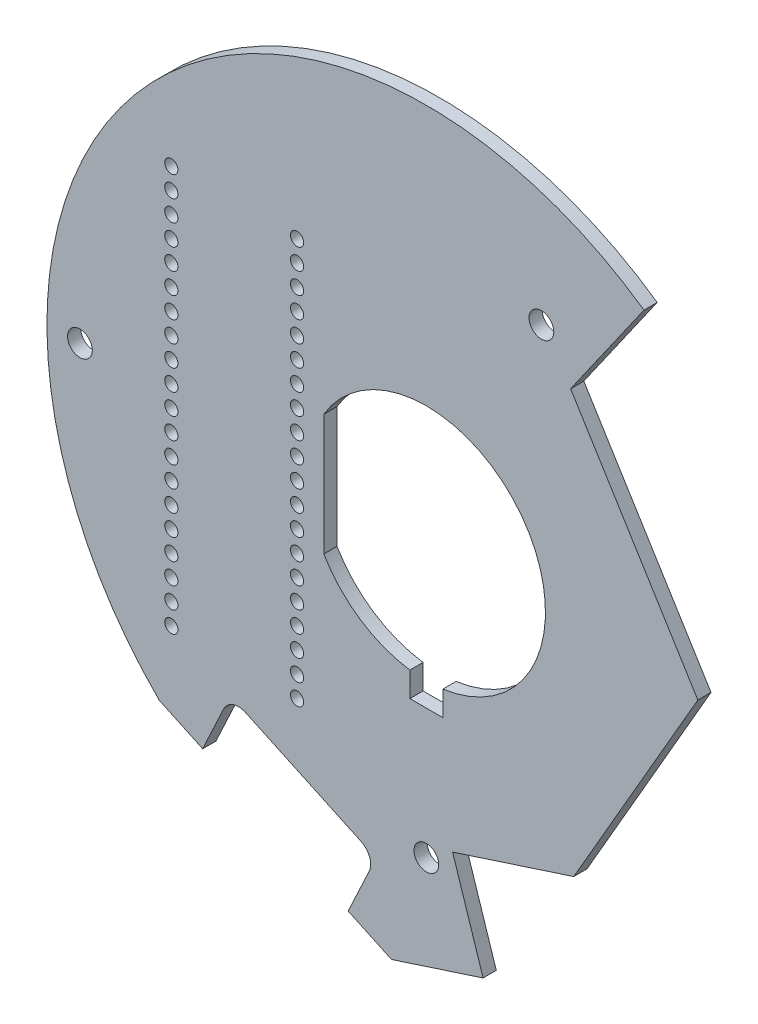
from build123d import *

# Parameters (mm, degrees)
BOSS_EXTRUDE1_DEPTH = 1.6
CUT_EXTRUDE1_DEPTH  = 1.6
SKETCH3_W           = 4
SKETCH3_H           = 3
CUT_EXTRUDE2_DEPTH  = 1.6
SKETCH4_R           = 1.5
CUT_EXTRUDE3_DEPTH  = 5
SKETCH5_R           = 0.8
CUT_EXTRUDE4_DEPTH  = 10
CUT_EXTRUDE5_DEPTH  = 10
CUT_EXTRUDE6_DEPTH  = 5
FILLET1_R           = 2


with BuildPart() as part:
    # Sketch1 → Boss-Extrude1 (new body)
    with BuildSketch(Plane.XY):
        with BuildLine():
            Line((17.486502451, 24.97331362), (26.384516072, 37.680994037))
            ThreePointArc((26.384516072, 37.680994037), (-35.308070708, 29.48457466), (-32.372261705, -32.680830346))
            Line((-32.372261705, -32.680830346), (-4.226479762, -45.805424011))
            ThreePointArc((-4.226479762, -45.805424011), (1.848027324, -45.962863216), (7.890286138, -45.318245604))
            Line((7.890286138, -45.318245604), (3.181347574, -30.825622907))
            Line((3.181347574, -30.825622907), (17.866632614, -26.054084553))
            Line((17.866632614, -26.054084553), (32.908965344, 0))
            Line((32.908965344, 0), (17.486502451, 24.97331362))
        make_face()
    extrude(amount=BOSS_EXTRUDE1_DEPTH)

    # Sketch2 → Cut-Extrude1 (cut)
    with BuildSketch(Plane.XY.offset(1.6)):
        with BuildLine():
            Line((-12.439410298, 7.331960256), (-12.439410298, -7.331960256))
            ThreePointArc((-12.439410298, -7.331960256), (14.439410298, 0), (-12.439410298, 7.331960256))
        make_face()
    extrude(amount=-CUT_EXTRUDE1_DEPTH, mode=Mode.SUBTRACT)

    # Sketch3 → Cut-Extrude2 (cut)
    with BuildSketch(Plane.XY.offset(1.6)):
        with Locations((0, -15.80022971)):
            Rectangle(SKETCH3_W, SKETCH3_H)
    extrude(amount=-CUT_EXTRUDE2_DEPTH, mode=Mode.SUBTRACT)

    # Sketch4 → Cut-Extrude3 (cut)
    with BuildSketch(Plane.XY.offset(1.6)):
        with Locations((-42, 0)):
            Circle(SKETCH4_R)
        with Locations((13.946402637, 29.908156972)):
            Circle(SKETCH4_R)
        with Locations((0, -33)):
            Circle(SKETCH4_R)
    extrude(amount=-CUT_EXTRUDE3_DEPTH, mode=Mode.SUBTRACT)

    # Sketch5 → Cut-Extrude4 (cut)
    with BuildSketch(Plane.XY.offset(1.6)):
        with Locations((-30.919410298, -24.13)):
            Circle(SKETCH5_R)
        with Locations((-15.679410309, -24.13)):
            Circle(SKETCH5_R)
        with Locations((-30.919410298, -21.59)):
            Circle(SKETCH5_R)
        with Locations((-15.679410309, -21.59)):
            Circle(SKETCH5_R)
        with Locations((-30.919410298, -19.05)):
            Circle(SKETCH5_R)
        with Locations((-15.679410309, -19.05)):
            Circle(SKETCH5_R)
        with Locations((-30.919410298, -16.51)):
            Circle(SKETCH5_R)
        with Locations((-15.679410309, -16.51)):
            Circle(SKETCH5_R)
        with Locations((-30.919410298, -13.97)):
            Circle(SKETCH5_R)
        with Locations((-15.679410309, -13.97)):
            Circle(SKETCH5_R)
        with Locations((-30.919410298, -11.43)):
            Circle(SKETCH5_R)
        with Locations((-15.679410309, -11.43)):
            Circle(SKETCH5_R)
        with Locations((-30.919410298, -8.89)):
            Circle(SKETCH5_R)
        with Locations((-15.679410309, -8.89)):
            Circle(SKETCH5_R)
        with Locations((-30.919410298, -6.35)):
            Circle(SKETCH5_R)
        with Locations((-15.679410309, -6.35)):
            Circle(SKETCH5_R)
        with Locations((-30.919410298, -3.81)):
            Circle(SKETCH5_R)
        with Locations((-15.679410309, -3.81)):
            Circle(SKETCH5_R)
        with Locations((-30.919410298, -1.27)):
            Circle(SKETCH5_R)
        with Locations((-15.679410309, -1.27)):
            Circle(SKETCH5_R)
        with Locations((-30.919410298, 1.27)):
            Circle(SKETCH5_R)
        with Locations((-15.679410309, 1.27)):
            Circle(SKETCH5_R)
        with Locations((-30.919410298, 3.81)):
            Circle(SKETCH5_R)
        with Locations((-15.679410309, 3.81)):
            Circle(SKETCH5_R)
        with Locations((-30.919410298, 6.35)):
            Circle(SKETCH5_R)
        with Locations((-15.679410309, 6.35)):
            Circle(SKETCH5_R)
        with Locations((-30.919410298, 8.89)):
            Circle(SKETCH5_R)
        with Locations((-15.679410309, 8.89)):
            Circle(SKETCH5_R)
        with Locations((-30.919410298, 11.43)):
            Circle(SKETCH5_R)
        with Locations((-15.679410309, 11.43)):
            Circle(SKETCH5_R)
        with Locations((-30.919410298, 13.97)):
            Circle(SKETCH5_R)
        with Locations((-15.679410309, 13.97)):
            Circle(SKETCH5_R)
        with Locations((-30.919410298, 16.51)):
            Circle(SKETCH5_R)
        with Locations((-15.679410309, 16.51)):
            Circle(SKETCH5_R)
        with Locations((-30.919410298, 19.05)):
            Circle(SKETCH5_R)
        with Locations((-15.679410309, 19.05)):
            Circle(SKETCH5_R)
        with Locations((-30.919410298, 21.59)):
            Circle(SKETCH5_R)
        with Locations((-15.679410309, 21.59)):
            Circle(SKETCH5_R)
        with Locations((-30.919410298, 24.13)):
            Circle(SKETCH5_R)
        with Locations((-15.679410309, 24.13)):
            Circle(SKETCH5_R)
    extrude(amount=-CUT_EXTRUDE4_DEPTH, mode=Mode.SUBTRACT)

    # Sketch6 → Cut-Extrude5 (cut)
    with BuildSketch(Plane.XY.offset(1.6)):
        Polygon((-4.226479762, -45.805424011), (6.876416094, -42.197874462), (21.084325359, -57.487819449), (-10.029151778, -66.166531288), align=None)
    extrude(amount=-CUT_EXTRUDE5_DEPTH, mode=Mode.SUBTRACT)

    # Sketch7 → Cut-Extrude6 (cut)
    with BuildSketch(Plane.XY.offset(1.6)):
        Polygon((-27.117745501, -35.131051492), (-23.736799407, -27.880589196), (-6.100049872, -36.104740569), (-9.480995966, -43.355202865), align=None)
    extrude(amount=-CUT_EXTRUDE6_DEPTH, mode=Mode.SUBTRACT)

    # Fillet1
    fillet1_edges = [part.edges().sort_by_distance(p)[0] for p in [
        (-23.736799407, -27.880589196, 0.8),
        (-6.100049872, -36.104740569, 0.8),
    ]]
    fillet(fillet1_edges, radius=FILLET1_R)


solid = part.part
